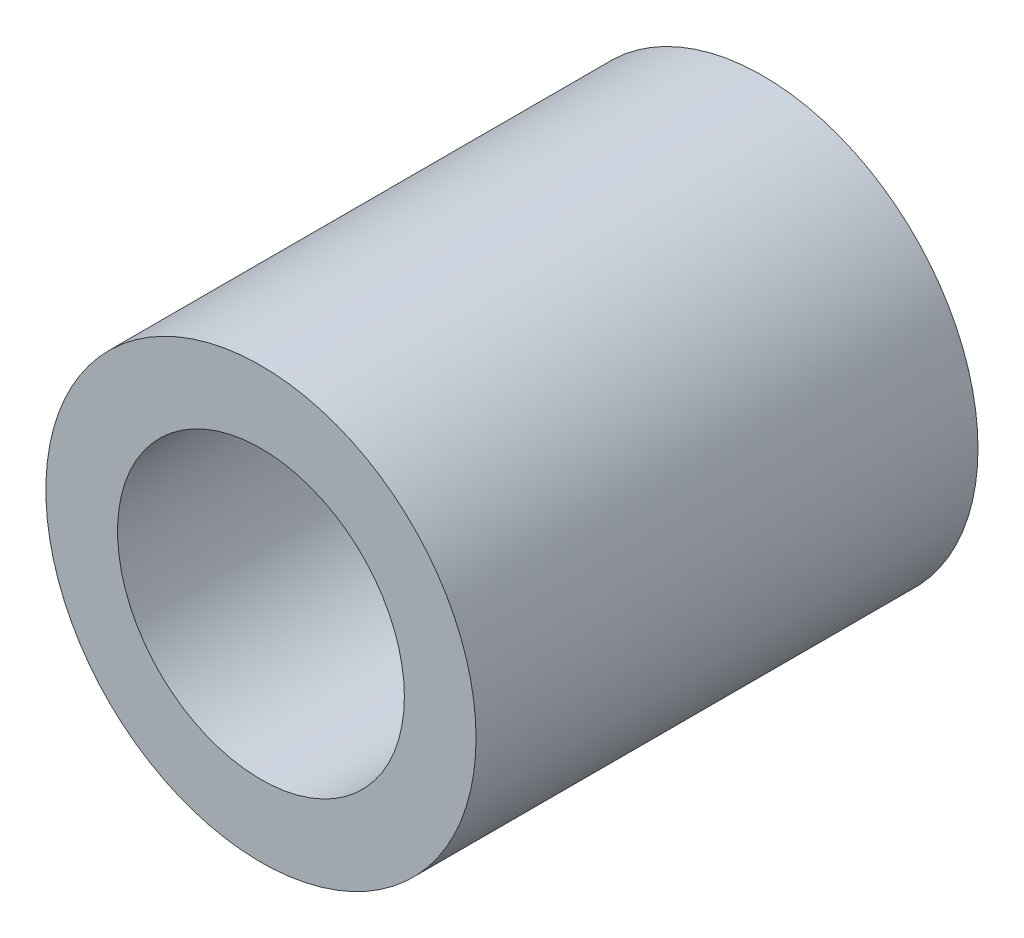
from build123d import *

# Parameters (mm, degrees)
SKETCH1_R           = 6
SKETCH1_R_2         = 4
BOSS_EXTRUDE1_DEPTH = 7


with BuildPart() as part:
    # Sketch1 → Boss-Extrude1 (new, symmetric)
    with BuildSketch(Plane.XY):
        Circle(SKETCH1_R)
        Circle(SKETCH1_R_2, mode=Mode.SUBTRACT)
    extrude(amount=BOSS_EXTRUDE1_DEPTH, both=True)


solid = part.part
